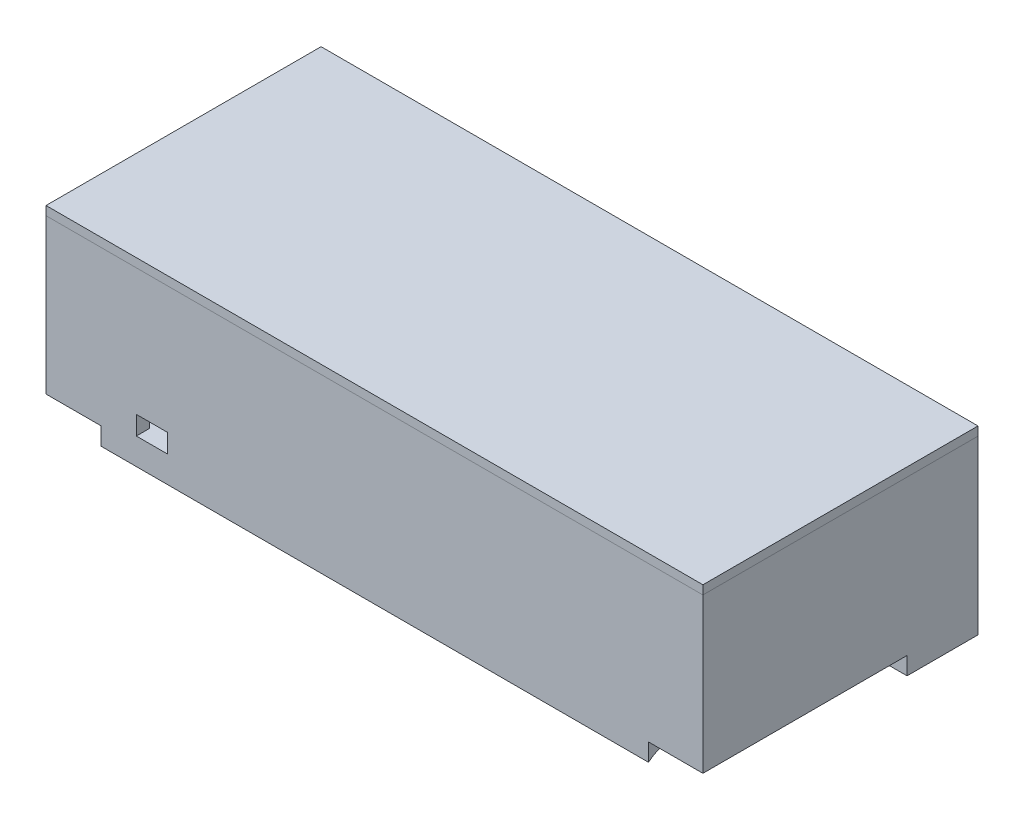
from build123d import *
from build123d.topology import SkipClean

# Parameters (mm, degrees)
SKETCH1_W            = 143.828049814
SKETCH1_H            = 56.322163605
SKETCH1_R            = 1.4
BOSS_EXTRUDE1_DEPTH  = 2
SKETCH1_3_R          = 1.4
BOSS_EXTRUDE2_DEPTH  = 6
FILLET1_R            = 0.6
SKETCH2_W            = 143.828049814
SKETCH2_H            = 35
SKETCH2_W_2          = 7.048392978
SKETCH2_H_2          = 4.249128256
BOSS_EXTRUDE3_DEPTH  = 3
SKETCH3_W            = 143.828049814
SKETCH3_H            = 35
SKETCH3_W_2          = 13.5
SKETCH3_H_2          = 13
BOSS_EXTRUDE4_DEPTH  = 3
SKETCH5_W            = 62.322163605
SKETCH5_H            = 35
BOSS_EXTRUDE7_DEPTH  = 2
SKETCH7_W            = 145.828049814
SKETCH7_H            = 15.750101034
SKETCH7_H_2          = 16.072062571
BOSS_EXTRUDE8_DEPTH  = 4
SKETCH8_W            = 13.5
SKETCH8_H            = 13
SKETCH8_R            = 5
BOSS_EXTRUDE13_DEPTH = 3
SKETCH8_3_W          = 15
SKETCH8_3_H          = 8.5
SKETCH8_3_R          = 3.5
CUT_EXTRUDE1_DEPTH   = 3
BOSS_EXTRUDE14_DEPTH = 3
SKETCH10_W           = 143.763404156
SKETCH10_H           = 56.022163605
SKETCH10_W_2         = 141.363404156
SKETCH10_H_2         = 53.622163605
BOSS_EXTRUDE15_DEPTH = 6
SKETCH11_W           = 148.828049814
SKETCH11_H           = 62.322163605
BOSS_EXTRUDE16_DEPTH = 2
CHAMFER1_SIZE        = 2
CUT_EXTRUDE2_DEPTH   = 4


with BuildPart() as part:
    # Sketch1 → Boss-Extrude1 (new body)
    with BuildSketch(Plane(origin=(0, 0, 0), x_dir=(1, 0, 0), z_dir=(0, 1, 0))):
        with Locations((-33.931180841, 0.065265579)):
            Rectangle(SKETCH1_W, SKETCH1_H)
        with Locations(Location((-17.6, 24.15, 0), (0, 0, 270))):
            Circle(SKETCH1_R, mode=Mode.SUBTRACT)
        with Locations(Location((-19, -24.15, 0), (0, 0, 270))):
            Circle(SKETCH1_R, mode=Mode.SUBTRACT)
        with Locations(Location((33.2, -19.05, 0), (0, 0, 270))):
            Circle(SKETCH1_R, mode=Mode.SUBTRACT)
        with Locations(Location((33.2, 8.85, 0), (0, 0, 270))):
            Circle(SKETCH1_R, mode=Mode.SUBTRACT)
        with Locations(Location((-100.905080181, 18.52052857, 0), (0, 0, 270))):
            Circle(SKETCH1_R, mode=Mode.SUBTRACT)
        with Locations(Location((-63.606715651, 18.52052857, 0), (0, 0, 270))):
            Circle(SKETCH1_R, mode=Mode.SUBTRACT)
        with Locations(Location((-100.905080181, -18.826293279, 0), (0, 0, 270))):
            Circle(SKETCH1_R, mode=Mode.SUBTRACT)
        with Locations(Location((-63.606715651, -18.826293279, 0), (0, 0, 270))):
            Circle(SKETCH1_R, mode=Mode.SUBTRACT)
    extrude(amount=BOSS_EXTRUDE1_DEPTH)

    # Sketch1<3> → Boss-Extrude2 (add)
    with BuildSketch(Plane(origin=(0, 0, 0), x_dir=(1, 0, 0), z_dir=(0, 1, 0))):
        with BuildLine():
            ThreePointArc((-62.206715651, 18.52052857), (-63.606715651, 19.92052857), (-65.006715651, 18.52052857))
            Line((-65.006715651, 18.52052857), (-63.606715651, 18.52052857))
            Line((-63.606715651, 18.52052857), (-63.606715651, 17.12052857))
            ThreePointArc((-63.606715651, 17.12052857), (-62.616766158, 17.530579076), (-62.206715651, 18.52052857))
        make_face()
        with BuildLine():
            Line((-63.606715651, 18.52052857), (-65.006715651, 18.52052857))
            ThreePointArc((-65.006715651, 18.52052857), (-64.596665145, 17.530579076), (-63.606715651, 17.12052857))
            Line((-63.606715651, 17.12052857), (-63.606715651, 18.52052857))
        make_face()
        with BuildLine():
            ThreePointArc((-99.505080181, 18.52052857), (-101.895029675, 19.510478063), (-100.905080181, 17.12052857))
            Line((-100.905080181, 17.12052857), (-100.905080181, 18.52052857))
            Line((-100.905080181, 18.52052857), (-99.505080181, 18.52052857))
        make_face()
        with BuildLine():
            Line((-100.905080181, 18.52052857), (-100.905080181, 17.12052857))
            ThreePointArc((-100.905080181, 17.12052857), (-99.915130687, 17.530579076), (-99.505080181, 18.52052857))
            Line((-99.505080181, 18.52052857), (-100.905080181, 18.52052857))
        make_face()
        with BuildLine():
            ThreePointArc((-63.606715651, -17.426293279), (-64.596665145, -17.836343785), (-65.006715651, -18.826293279))
            Line((-65.006715651, -18.826293279), (-63.606715651, -18.826293279))
            Line((-63.606715651, -18.826293279), (-63.606715651, -17.426293279))
        make_face()
        with BuildLine():
            Line((-63.606715651, -18.826293279), (-65.006715651, -18.826293279))
            ThreePointArc((-65.006715651, -18.826293279), (-63.606715651, -20.226293279), (-62.206715651, -18.826293279))
            ThreePointArc((-62.206715651, -18.826293279), (-62.616766158, -17.836343785), (-63.606715651, -17.426293279))
            Line((-63.606715651, -17.426293279), (-63.606715651, -18.826293279))
        make_face()
        with BuildLine():
            Line((-99.505080181, -18.826293279), (-100.905080181, -18.826293279))
            Line((-100.905080181, -18.826293279), (-100.905080181, -17.426293279))
            ThreePointArc((-100.905080181, -17.426293279), (-101.895029675, -19.816242772), (-99.505080181, -18.826293279))
        make_face()
        with BuildLine():
            Line((-100.905080181, -17.426293279), (-100.905080181, -18.826293279))
            Line((-100.905080181, -18.826293279), (-99.505080181, -18.826293279))
            ThreePointArc((-99.505080181, -18.826293279), (-99.915130687, -17.836343785), (-100.905080181, -17.426293279))
        make_face()
        with Locations(Location((33.2, 8.85, 0), (0, 0, 270))):
            Circle(SKETCH1_3_R)
        with Locations(Location((-17.6, 24.15, 0), (0, 0, 270))):
            Circle(SKETCH1_3_R)
        with Locations(Location((-19, -24.15, 0), (0, 0, 270))):
            Circle(SKETCH1_3_R)
        with Locations(Location((33.2, -19.05, 0), (0, 0, 270))):
            Circle(SKETCH1_3_R)
    extrude(amount=BOSS_EXTRUDE2_DEPTH)

    # Fillet1
    fillet1_edges = [part.edges().sort_by_distance(p)[0] for p in [
        (-100.905080181, 6, -19.92052857),
        (-62.206715651, 6, -18.52052857),
        (-65.006715651, 6, 18.826293279),
        (-102.305080181, 6, 18.826293279),
        (33.2, 6, -10.25),
        (-17.6, 6, -25.55),
        (-19, 6, 22.75),
        (33.2, 6, 17.65),
    ]]
    fillet(fillet1_edges, radius=FILLET1_R)

    # Sketch2 → Boss-Extrude3 (add)
    with BuildSketch(Plane.XY.offset(28.095816224)):
        with Locations((-33.931180841, 17.5)):
            Rectangle(SKETCH2_W, SKETCH2_H)
        with Locations((-84.850762702, 4.124564128)):
            Rectangle(SKETCH2_W_2, SKETCH2_H_2, mode=Mode.SUBTRACT)
    extrude(amount=BOSS_EXTRUDE3_DEPTH)

    # Sketch3 → Boss-Extrude4 (add)
    with BuildSketch(Plane(origin=(0, 0, -28.226347381), x_dir=(-1, 0, 0), z_dir=(0, 0, -1))):
        with Locations((33.931180841, 17.5)):
            Rectangle(SKETCH3_W, SKETCH3_H)
        with Locations((45.75, 8.5)):
            Rectangle(SKETCH3_W_2, SKETCH3_H_2, mode=Mode.SUBTRACT)
    extrude(amount=BOSS_EXTRUDE4_DEPTH)

    # Sketch5 → Boss-Extrude7 (add)
    with BuildSketch(Plane(origin=(37.982844066, 0, 0), x_dir=(0, 0, -1), z_dir=(1, 0, 0))):
        with Locations((0.065265579, 17.5)):
            Rectangle(SKETCH5_W, SKETCH5_H)
    extrude(amount=BOSS_EXTRUDE7_DEPTH)

    # Sketch7 → Boss-Extrude8 (add)
    with BuildSketch(Plane(origin=(0, 0, 0), x_dir=(-1, 0, 0), z_dir=(0, -1, 0))):
        with Locations((32.931180841, -23.220765707)):
            Rectangle(SKETCH7_W, SKETCH7_H)
        with Locations((32.931180841, 23.190316096)):
            Rectangle(SKETCH7_W, SKETCH7_H_2)
    extrude(amount=BOSS_EXTRUDE8_DEPTH)

    # Sketch8 → Boss-Extrude13 (add)
    # profile 1 of 2: a face of its own
    with SkipClean():  # the faces are left unmerged after this step: merging them gives an invalid solid
        with BuildSketch(Plane(origin=(0, 0, -31.226347381), x_dir=(-1, 0, 0), z_dir=(0, 0, -1))):
            with Locations((45.75, 8.5)):
                Rectangle(SKETCH8_W, SKETCH8_H)
            with Locations((45.75, 8.5)):
                Circle(SKETCH8_R, mode=Mode.SUBTRACT)
        # profile 2 of 2: a face of its own
        with BuildSketch(Plane(origin=(0, 0, -31.226347381), x_dir=(-1, 0, 0), z_dir=(0, 0, -1))):
            with BuildLine():
                Line((45.75, 13.5), (45.75, 15))
                Line((45.75, 15), (39, 15))
                Line((39, 15), (39, 2))
                Line((39, 2), (45.75, 2))
                Line((45.75, 2), (45.75, 3.5))
                ThreePointArc((45.75, 3.5), (40.75, 8.5), (45.75, 13.5))
            make_face()
        extrude(amount=-BOSS_EXTRUDE13_DEPTH)

    # Sketch8<3> → Cut-Extrude1 (cut)
    with SkipClean():  # the faces are left unmerged after this step: merging them gives an invalid solid
        with BuildSketch(Plane(origin=(0, 0, -31.226347381), x_dir=(-1, 0, 0), z_dir=(0, 0, -1))):
            with Locations((16.5, 21.25)):
                Rectangle(SKETCH8_3_W, SKETCH8_3_H)
            with Locations((72.5, 24)):
                Circle(SKETCH8_3_R)
        extrude(amount=-CUT_EXTRUDE1_DEPTH, mode=Mode.SUBTRACT)

    # Sketch9 → Boss-Extrude14 (add)
    with SkipClean():  # the faces are left unmerged after this step: merging them gives an invalid solid
        with BuildSketch(Plane.ZY.offset(105.845205748)):
            Polygon((-28.226347381, 35), (28.095816224, 35), (31.095816224, 35), (31.095816224, -4), (15.34571519, -4), (15.34571519, 0), (-15.15428481, 0), (-15.15428481, -4), (-31.226347381, -4), (-31.226347381, 35), align=None)
        extrude(amount=BOSS_EXTRUDE14_DEPTH)

    # Sketch13 → Cut-Extrude2 (cut)
    with SkipClean():  # the faces are left unmerged after this step: merging them gives an invalid solid
        with BuildSketch(Plane(origin=(0, -4, 0), x_dir=(-1, 0, 0), z_dir=(0, -1, 0))):
            with BuildLine():
                Line((-44.778286925, -7.523396123), (-49.568819159, -45.04571519))
                ThreePointArc((-49.568819159, -45.04571519), (-32.456835054, -37.957699295), (-25.368819159, -20.84571519))
                Line((-25.368819159, -20.84571519), (-25.368819159, -14.84571519))
                Line((-25.368819159, -14.84571519), (94.231180841, -13.382807013))
                Line((94.231180841, -13.382807013), (94.231180841, -21.34571519))
                ThreePointArc((94.231180841, -21.34571519), (101.172750127, -38.104145904), (117.931180841, -45.04571519))
                Line((117.931180841, -45.04571519), (112.257259812, -6.476658502))
                Line((112.257259812, -6.476658502), (-44.778286925, -7.523396123))
            make_face()
        extrude(amount=-CUT_EXTRUDE2_DEPTH, mode=Mode.SUBTRACT)


with BuildPart() as body_2:
    # Sketch10 → Boss-Extrude15 (new body)
    with BuildSketch(Plane(origin=(0, 35, 0), x_dir=(1, 0, 0), z_dir=(0, 1, 0))):
        with Locations((-33.81350367, 0.065265579)):
            Rectangle(SKETCH10_W, SKETCH10_H)
        with Locations((-33.81350367, 0.065265579)):
            Rectangle(SKETCH10_W_2, SKETCH10_H_2, mode=Mode.SUBTRACT)
    extrude(amount=-BOSS_EXTRUDE15_DEPTH)

    # Sketch11 → Boss-Extrude16 (add)
    with BuildSketch(Plane(origin=(0, 35, 0), x_dir=(1, 0, 0), z_dir=(0, 1, 0))):
        with Locations((-34.431180841, 0.065265579)):
            Rectangle(SKETCH11_W, SKETCH11_H)
    extrude(amount=BOSS_EXTRUDE16_DEPTH)

    # Chamfer1
    chamfer1_edges = [body_2.edges().sort_by_distance(p)[0] for p in [
        (-33.81350367, 35, -26.876347381),
        (-104.495205748, 35, -0.065265578),
        (-33.81350367, 35, 26.745816224),
        (36.868198408, 35, -0.065265578),
    ]]
    chamfer(chamfer1_edges, length=CHAMFER1_SIZE)


solid = Compound([part.part, body_2.part])
